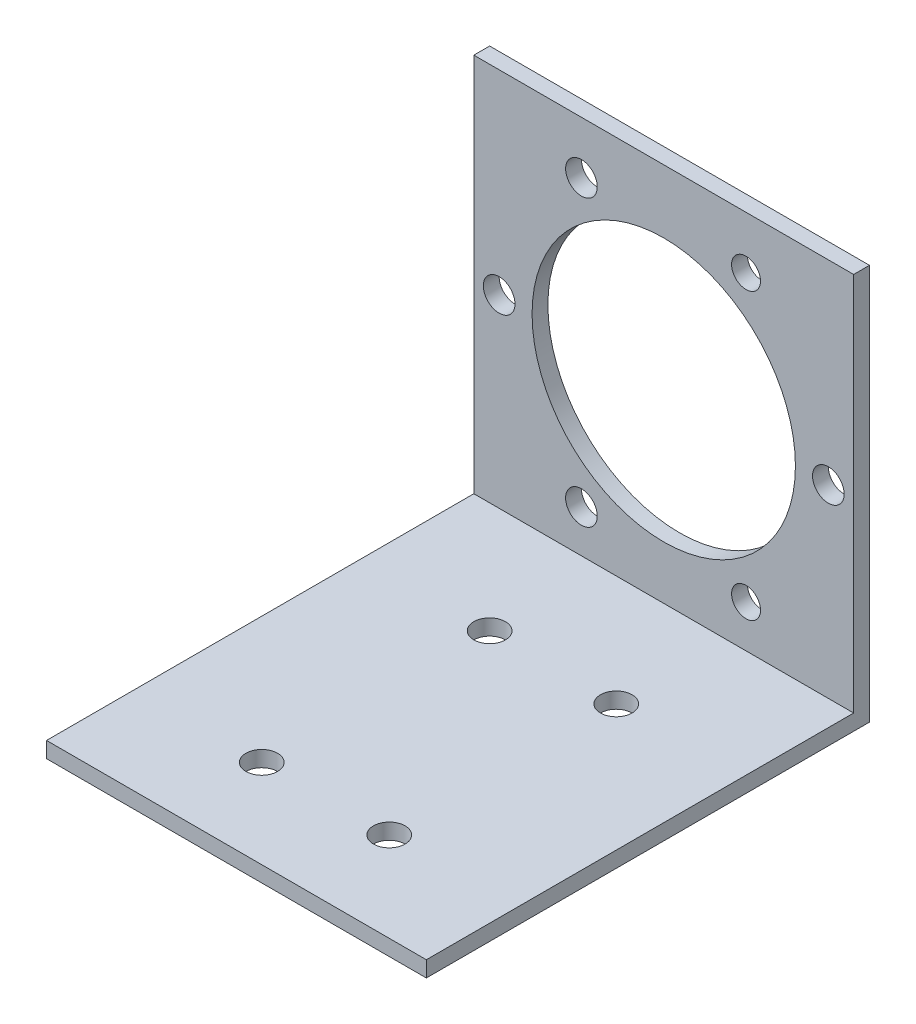
from build123d import *

# Parameters (mm, degrees)
SKETCH1_W                      = 38.1
SKETCH1_H                      = 1.5875
BOSS_EXTRUDE1_DEPTH            = 44.45
SKETCH2_W                      = 38.1
SKETCH2_H                      = 1.5875
BOSS_EXTRUDE2_DEPTH            = 38.1
SKETCH3_R                      = 13.208
CUT_EXTRUDE1_DEPTH             = 71.728425377
F_1_8_0_125_DIAMETER_HOLE3_D   = 3.175
F_1_8_0_125_DIAMETER_HOLE4_D   = 3.175
F_2_9_2_9_DIAMETER_HOLE1_D     = 2.9
F_2_9_2_9_DIAMETER_HOLE1_DEPTH = 3.556
F_2_9_2_9_DIAMETER_HOLE1_TIP   = 0.871247898


with BuildPart() as part:
    # Sketch1 → Boss-Extrude1 (new body)
    with BuildSketch(Plane.XY):
        with Locations((19.05, 0.79375)):
            Rectangle(SKETCH1_W, SKETCH1_H)
    extrude(amount=BOSS_EXTRUDE1_DEPTH)

    # Sketch2 → Boss-Extrude2 (add)
    with BuildSketch(Plane(origin=(0, 1.5875, 0), x_dir=(1, 0, 0), z_dir=(0, 1, 0))):
        with Locations((19.05, -0.79375)):
            Rectangle(SKETCH2_W, SKETCH2_H)
    extrude(amount=BOSS_EXTRUDE2_DEPTH)

    # Sketch3 → Cut-Extrude1 (cut, through all)
    with BuildSketch(Plane(origin=(0, 0, 0), x_dir=(-1, 0, 0), z_dir=(0, 0, -1))):
        with Locations((-19.05, 20.1295)):
            Circle(SKETCH3_R)
    extrude(amount=-CUT_EXTRUDE1_DEPTH, mode=Mode.SUBTRACT)

    # 1/8 (0.125) Diameter Hole3 (through all)
    with Locations(Plane(origin=(0, 0, 0), x_dir=(-1, 0, 0), z_dir=(0, 0, -1))):
        with Locations((-35.56, 20.1295), (-10.795, 34.427579416), (-2.54, 20.1295), (-10.795, 5.831420584)):
            Hole(F_1_8_0_125_DIAMETER_HOLE3_D / 2)

    # 1/8 (0.125) Diameter Hole4 (through all)
    with Locations(Plane(origin=(0, 1.5875, 0), x_dir=(1, 0, 0), z_dir=(0, 1, 0))):
        with Locations((25.4, -12.7), (12.7, -12.7), (12.7, -35.56), (25.4, -35.469930371)):
            Hole(F_1_8_0_125_DIAMETER_HOLE4_D / 2)

    # Ø2.9 (2.9) Diameter Hole1
    with Locations(Plane(origin=(0, 0, 0), x_dir=(-1, 0, 0), z_dir=(0, 0, -1))):
        with Locations((-27.305, 5.831420584), (-27.305, 34.427579416)):
            Hole(F_2_9_2_9_DIAMETER_HOLE1_D / 2, depth=F_2_9_2_9_DIAMETER_HOLE1_DEPTH)
            with Locations((0, 0, -(F_2_9_2_9_DIAMETER_HOLE1_DEPTH + F_2_9_2_9_DIAMETER_HOLE1_TIP / 2))):  # 118° drill point
                Cone(0, F_2_9_2_9_DIAMETER_HOLE1_D / 2, F_2_9_2_9_DIAMETER_HOLE1_TIP, mode=Mode.SUBTRACT)


solid = part.part
